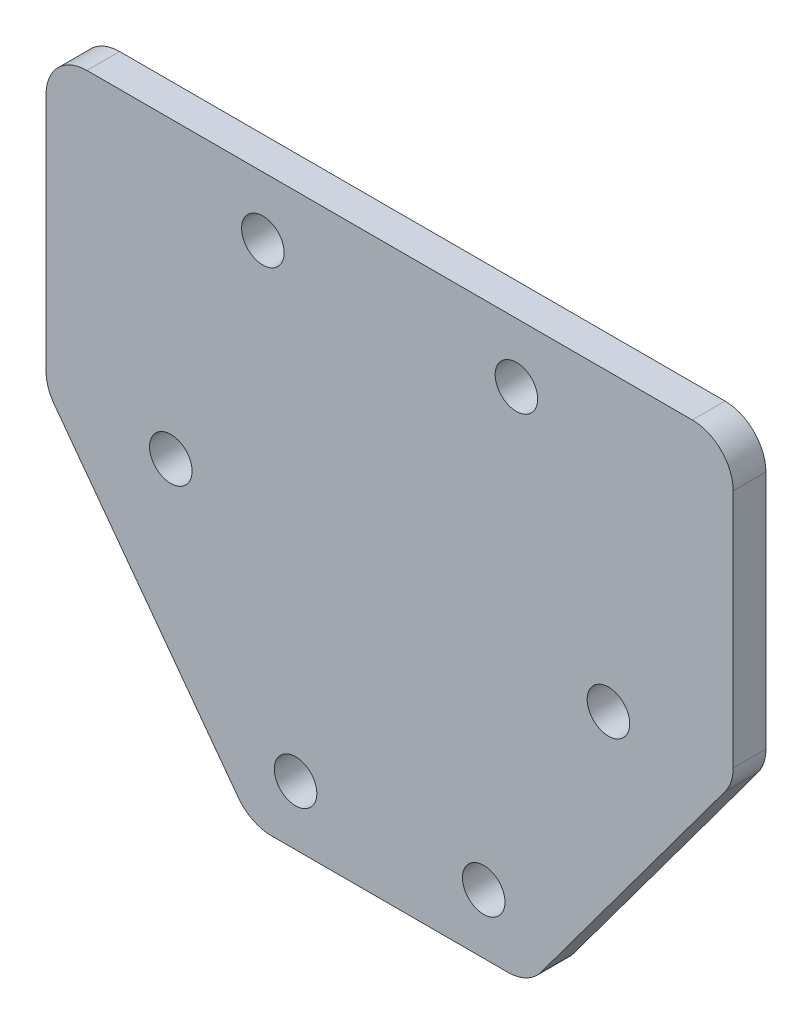
from build123d import *

# Parameters (mm, degrees)
SKETCH1_R           = 2.6
BOSS_EXTRUDE1_DEPTH = 4
FILLET1_R           = 5


with BuildPart() as part:
    # Sketch1 → Boss-Extrude1 (new body)
    with BuildSketch(Plane.XY):
        Polygon((-17, -51.749074061), (17, -51.749074061), (42, -18), (42, 18), (-42, 18), (-42, -18), align=None)
        with Locations((-15.5, 10.75)):
            Circle(SKETCH1_R, mode=Mode.SUBTRACT)
        with Locations((15.5, 10.75)):
            Circle(SKETCH1_R, mode=Mode.SUBTRACT)
        with Locations((-26.75, -18)):
            Circle(SKETCH1_R, mode=Mode.SUBTRACT)
        with Locations((26.75, -18)):
            Circle(SKETCH1_R, mode=Mode.SUBTRACT)
        with Locations((-11.5, -44.499074061)):
            Circle(SKETCH1_R, mode=Mode.SUBTRACT)
        with Locations((11.5, -44.499074061)):
            Circle(SKETCH1_R, mode=Mode.SUBTRACT)
    extrude(amount=BOSS_EXTRUDE1_DEPTH)

    # Fillet1
    fillet1_edges = [part.edges().sort_by_distance(p)[0] for p in [
        (17, -51.749074061, 2),
        (-17, -51.749074061, 2),
        (-42, -18, 2),
        (-42, 18, 2),
        (42, 18, 2),
        (42, -18, 2),
    ]]
    fillet(fillet1_edges, radius=FILLET1_R)


solid = part.part
